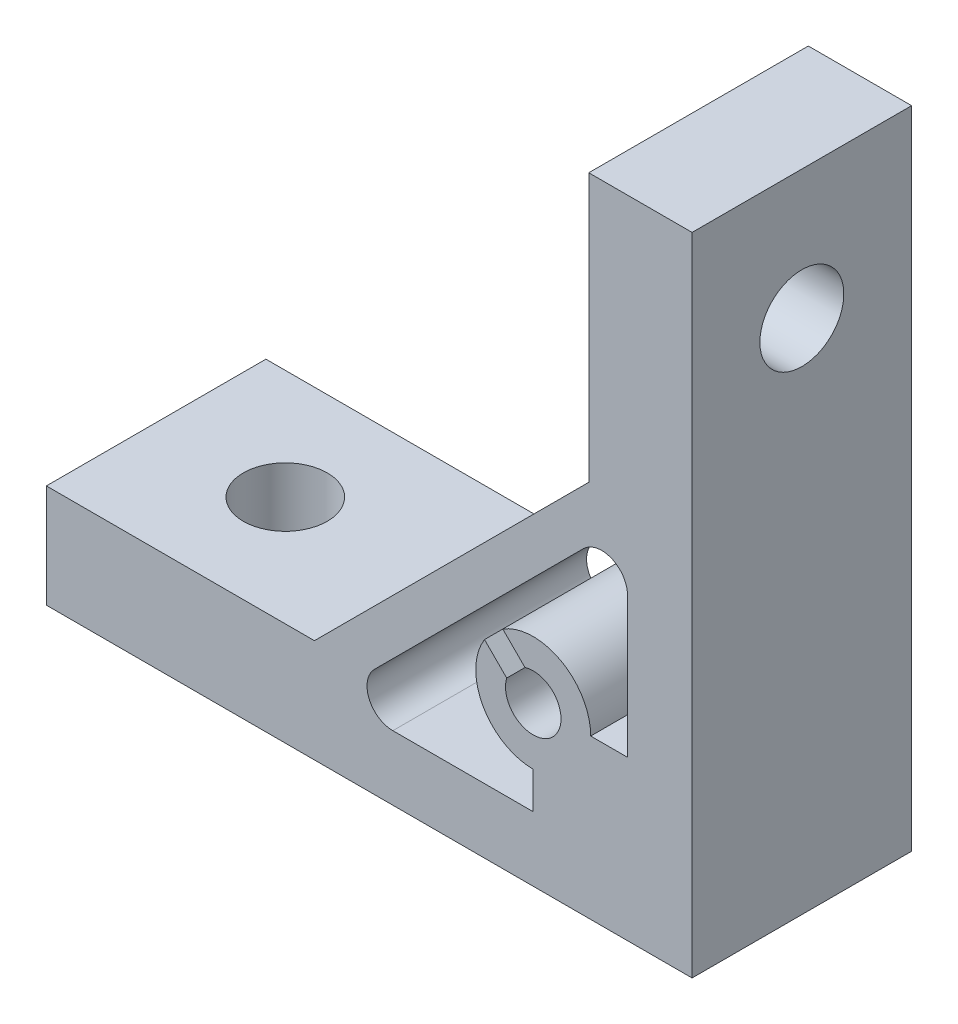
from build123d import *

# Parameters (mm, degrees)
EXTRUDE_1_DEPTH     = 8.5
SKETCH_3_R          = 3.25
CUT_EXTRUDE_1_DEPTH = 17


with BuildPart() as part:
    # 草图1 → 凸台-拉伸1 (new, symmetric)
    with BuildSketch(Plane.XY):
        Polygon((0, 0), (50, 0), (50, 50), (42, 50), (42, 29.242640687), (20.757359313, 8), (0, 8), align=None)
        with BuildLine():
            Line((37.061279898, 14.352933665), (35.340960992, 16.07325257))
            ThreePointArc((35.340960992, 16.07325257), (39.856939547, 16.192314452), (42.15, 12.3))
            Line((42.15, 12.3), (45, 12.3))
            Line((45, 12.3), (45, 23.171572875))
            ThreePointArc((45, 23.171572875), (43.765366865, 25.01933194), (41.585786438, 24.585786438))
            Line((41.585786438, 24.585786438), (25.414213562, 8.414213562))
            ThreePointArc((25.414213562, 8.414213562), (24.98066806, 6.234633135), (26.828427125, 5))
            Line((26.828427125, 5), (37.7, 5))
            Line((37.7, 5), (37.7, 7.85))
            ThreePointArc((37.7, 7.85), (33.807685548, 10.143060453), (33.92674743, 14.659039008))
            Line((33.92674743, 14.659039008), (35.647066335, 12.938720102))
            ThreePointArc((35.647066335, 12.938720102), (39.22027958, 10.77972042), (37.061279898, 14.352933665))
        make_face(mode=Mode.SUBTRACT)
    extrude(amount=EXTRUDE_1_DEPTH, both=True)

    # 草图3 → 切除-拉伸1 (cut)
    with BuildSketch(Plane(origin=(0, 8, 0), x_dir=(1, 0, 0), z_dir=(0, 1, 0))):
        with Locations(Location((10, 0, 0), (0, 0, 270))):
            Circle(SKETCH_3_R)
    cut_extrude_1 = extrude(amount=-CUT_EXTRUDE_1_DEPTH, mode=Mode.SUBTRACT)

    # 镜向1: 切除-拉伸1 across plane
    add(cut_extrude_1.mirror(Plane(origin=(25, 25, 0), x_dir=(0, 0, 1), z_dir=(-0.7071067811865486, -0.7071067811865465, 0))), mode=Mode.SUBTRACT)


solid = part.part
